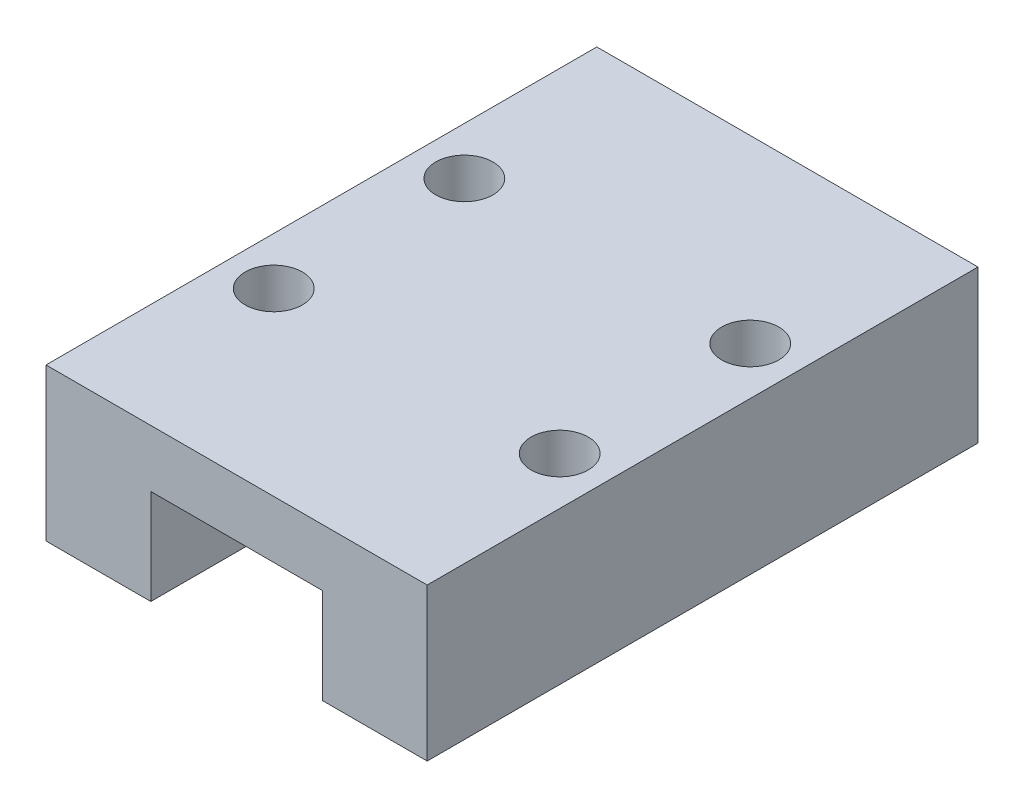
from build123d import *

# Parameters (mm, degrees)
EXTRUDE_1_DEPTH     = 28.9
SKETCH_2_R          = 1.5
CUT_EXTRUDE_1_DEPTH = 5


with BuildPart() as part:
    # 草图1 → 凸台-拉伸1 (new body)
    with BuildSketch(Plane.XY):
        Polygon((0, 0), (-5.5, 0), (-5.5, 5), (-14.5, 5), (-14.5, 0), (-20, 0), (-20, 8), (0, 8), align=None)
    extrude(amount=EXTRUDE_1_DEPTH)

    # 草图2 → 切除-拉伸1 (cut)
    with BuildSketch(Plane(origin=(0, 8, 0), x_dir=(1, 0, 0), z_dir=(0, 1, 0))):
        with Locations(Location((-17.5, -9.45, 0), (0, 0, 180))):
            Circle(SKETCH_2_R)
        with Locations((-2.5, -9.45)):
            Circle(SKETCH_2_R)
        with Locations(Location((-2.5, -19.45, 0), (0, 0, 180))):
            Circle(SKETCH_2_R)
        with Locations((-17.5, -19.45)):
            Circle(SKETCH_2_R)
    extrude(amount=-CUT_EXTRUDE_1_DEPTH, mode=Mode.SUBTRACT)


solid = part.part
